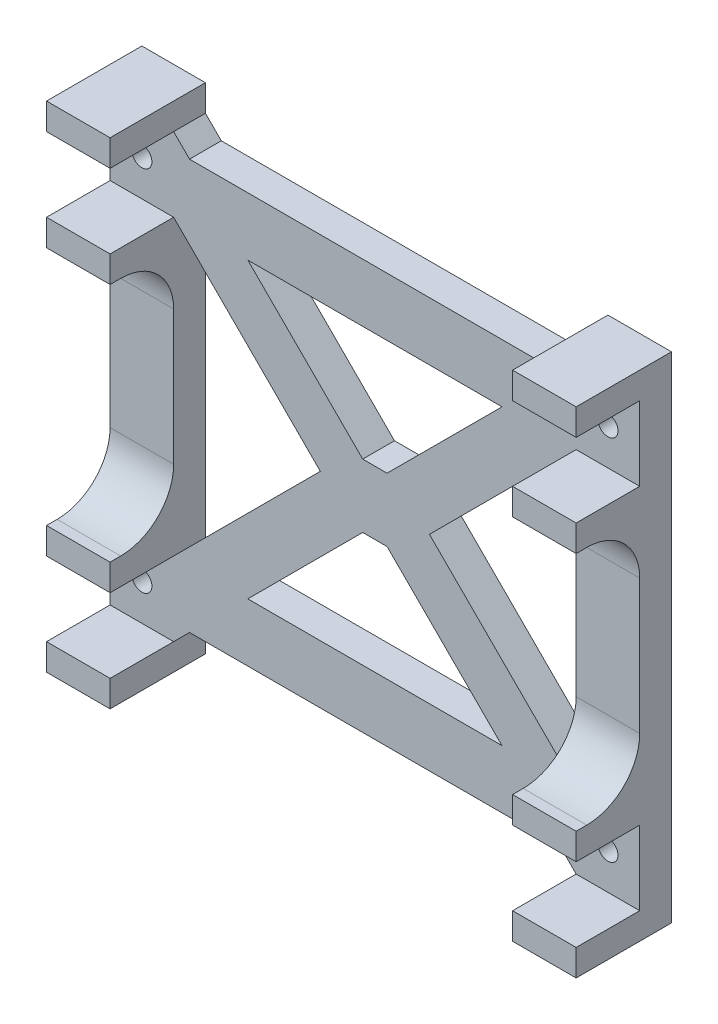
from build123d import *

# Parameters (mm, degrees)
ESQUISSE1_W                    = 6
ESQUISSE1_H                    = 42.7
ESQUISSE1_R                    = 0.95
BOSS_EXTRU_1_DEPTH             = 3
ESQUISSE2_W                    = 6
ESQUISSE2_H                    = 2.5
BOSS_EXTRU_2_DEPTH             = 6
BOSS_EXTRU_2_DIRECTION_2_REACH = 40.932
ESQUISSE3_W                    = 3
ESQUISSE3_H                    = 46.7
BOSS_EXTRU_4_DEPTH             = 44
ESQUISSE4_W                    = 9
ESQUISSE4_H                    = 2.5
BOSS_EXTRU_5_DEPTH             = 6
ENL_V_MAT_EXTRU_1_REACH        = 64.462
ESQUISSE5_R                    = 0.95
ENL_V_MAT_EXTRU_2_REACH        = 64.462
CONG_1_R                       = 5


with BuildPart() as part:
    # Esquisse1 → Boss.-Extru.1 (new body)
    with BuildSketch(Plane.XY):
        with Locations((0, 17.35)):
            Rectangle(ESQUISSE1_W, ESQUISSE1_H)
        Circle(ESQUISSE1_R, mode=Mode.SUBTRACT)
        with Locations((0, 34.7)):
            Circle(ESQUISSE1_R, mode=Mode.SUBTRACT)
    extrude(amount=BOSS_EXTRU_1_DEPTH)

    # Esquisse2 → Boss.-Extru.2 (add)
    with BuildSketch(Plane.XY.offset(3)):
        with Locations((0, 4.75)):
            Rectangle(ESQUISSE2_W, ESQUISSE2_H)
        with Locations((0, 39.45)):
            Rectangle(ESQUISSE2_W, ESQUISSE2_H)
        with Locations((0, 29.95)):
            Rectangle(ESQUISSE2_W, ESQUISSE2_H)
        with Locations((0, -4.75)):
            Rectangle(ESQUISSE2_W, ESQUISSE2_H)
    extrude(amount=BOSS_EXTRU_2_DEPTH)

    # Boss.-Extru.2 direction 2: up to this face of the body (flat: up to its plane)
    boss_extru_2_direction_2_end = Plane(part.part.faces().sort_by_distance((0, 17.35, 0))[0])
    # Esquisse2 → Boss.-Extru.2 direction 2 (add, up to the picked face)
    with BuildSketch(Plane.XY.offset(3), mode=Mode.PRIVATE) as boss_extru_2_direction_2_sk1:
        with Locations((0, 4.75)):
            Rectangle(ESQUISSE2_W, ESQUISSE2_H)
    boss_extru_2_direction_2_tool1 = split(extrude(boss_extru_2_direction_2_sk1.sketch, amount=-BOSS_EXTRU_2_DIRECTION_2_REACH, mode=Mode.PRIVATE), bisect_by=boss_extru_2_direction_2_end, keep=Keep.BOTH, mode=Mode.PRIVATE)
    # Esquisse2 → Boss.-Extru.2 direction 2 (add, up to the picked face)
    with BuildSketch(Plane.XY.offset(3), mode=Mode.PRIVATE) as boss_extru_2_direction_2_sk2:
        with Locations((0, 39.45)):
            Rectangle(ESQUISSE2_W, ESQUISSE2_H)
    boss_extru_2_direction_2_tool2 = split(extrude(boss_extru_2_direction_2_sk2.sketch, amount=-BOSS_EXTRU_2_DIRECTION_2_REACH, mode=Mode.PRIVATE), bisect_by=boss_extru_2_direction_2_end, keep=Keep.BOTH, mode=Mode.PRIVATE)
    # Esquisse2 → Boss.-Extru.2 direction 2 (add, up to the picked face)
    with BuildSketch(Plane.XY.offset(3), mode=Mode.PRIVATE) as boss_extru_2_direction_2_sk3:
        with Locations((0, 29.95)):
            Rectangle(ESQUISSE2_W, ESQUISSE2_H)
    boss_extru_2_direction_2_tool3 = split(extrude(boss_extru_2_direction_2_sk3.sketch, amount=-BOSS_EXTRU_2_DIRECTION_2_REACH, mode=Mode.PRIVATE), bisect_by=boss_extru_2_direction_2_end, keep=Keep.BOTH, mode=Mode.PRIVATE)
    # Esquisse2 → Boss.-Extru.2 direction 2 (add, up to the picked face)
    with BuildSketch(Plane.XY.offset(3), mode=Mode.PRIVATE) as boss_extru_2_direction_2_sk4:
        with Locations((0, -4.75)):
            Rectangle(ESQUISSE2_W, ESQUISSE2_H)
    boss_extru_2_direction_2_tool4 = split(extrude(boss_extru_2_direction_2_sk4.sketch, amount=-BOSS_EXTRU_2_DIRECTION_2_REACH, mode=Mode.PRIVATE), bisect_by=boss_extru_2_direction_2_end, keep=Keep.BOTH, mode=Mode.PRIVATE)
    add(boss_extru_2_direction_2_tool1.solids().sort_by(Axis((0, 4.75, 3), (0, 0, -1)))[0])
    add(boss_extru_2_direction_2_tool2.solids().sort_by(Axis((0, 39.45, 3), (0, 0, -1)))[0])
    add(boss_extru_2_direction_2_tool3.solids().sort_by(Axis((0, 29.95, 3), (0, 0, -1)))[0])
    add(boss_extru_2_direction_2_tool4.solids().sort_by(Axis((0, -4.75, 3), (0, 0, -1)))[0])

    # Esquisse3 → Boss.-Extru.4 (add)
    with BuildSketch(Plane.ZY.offset(3)):
        with Locations((1.5, 17.35)):
            Rectangle(ESQUISSE3_W, ESQUISSE3_H)
    extrude(amount=BOSS_EXTRU_4_DEPTH)

    # Esquisse4 → Boss.-Extru.5 (add)
    with BuildSketch(Plane.ZY.offset(47)):
        with Locations((4.5, 39.45)):
            Rectangle(ESQUISSE4_W, ESQUISSE4_H)
        with Locations((4.5, 29.95)):
            Rectangle(ESQUISSE4_W, ESQUISSE4_H)
        with Locations((4.5, 4.75)):
            Rectangle(ESQUISSE4_W, ESQUISSE4_H)
        with Locations((4.5, -4.75)):
            Rectangle(ESQUISSE4_W, ESQUISSE4_H)
    extrude(amount=-BOSS_EXTRU_5_DEPTH)

    # Esquisse5 → Enlèv. mat.-Extru.1 (cut, up to next)
    with BuildSketch(Plane.XY.offset(3), mode=Mode.PRIVATE) as enl_v_mat_extru_1_sk1:
        with Locations((-44, 34.7)):
            Circle(ESQUISSE5_R)
    enl_v_mat_extru_1_tool1 = extrude(enl_v_mat_extru_1_sk1.sketch, amount=-ENL_V_MAT_EXTRU_1_REACH, mode=Mode.PRIVATE) & part.part
    # Esquisse5 → Enlèv. mat.-Extru.1 (cut, up to next)
    with BuildSketch(Plane.XY.offset(3), mode=Mode.PRIVATE) as enl_v_mat_extru_1_sk2:
        with Locations((-44, 0)):
            Circle(ESQUISSE5_R)
    enl_v_mat_extru_1_tool2 = extrude(enl_v_mat_extru_1_sk2.sketch, amount=-ENL_V_MAT_EXTRU_1_REACH, mode=Mode.PRIVATE) & part.part
    add(enl_v_mat_extru_1_tool1.solids().sort_by_distance((-44, 34.7, 3))[0], mode=Mode.SUBTRACT)
    add(enl_v_mat_extru_1_tool2.solids().sort_by_distance((-44, 0, 3))[0], mode=Mode.SUBTRACT)

    # Esquisse6 → Enlèv. mat.-Extru.2 (cut, up to next)
    with BuildSketch(Plane.XY.offset(3), mode=Mode.PRIVATE) as enl_v_mat_extru_2_sk1:
        Polygon((-20.85, 20.35), (-23.15, 20.35), (-34, 31.2), (-10, 31.2), align=None)
    enl_v_mat_extru_2_tool1 = extrude(enl_v_mat_extru_2_sk1.sketch, amount=-ENL_V_MAT_EXTRU_2_REACH, mode=Mode.PRIVATE) & part.part
    # Esquisse6 → Enlèv. mat.-Extru.2 (cut, up to next)
    with BuildSketch(Plane.XY.offset(3), mode=Mode.PRIVATE) as enl_v_mat_extru_2_sk2:
        Polygon((-41, 28.7), (-41, 6), (-41, 3.5), (-27.15, 17.35), (-41, 31.2), align=None)
    enl_v_mat_extru_2_tool2 = extrude(enl_v_mat_extru_2_sk2.sketch, amount=-ENL_V_MAT_EXTRU_2_REACH, mode=Mode.PRIVATE) & part.part
    # Esquisse6 → Enlèv. mat.-Extru.2 (cut, up to next)
    with BuildSketch(Plane.XY.offset(3), mode=Mode.PRIVATE) as enl_v_mat_extru_2_sk3:
        Polygon((-3, 28.7), (-3, 6), (-3, 3.5), (-16.85, 17.35), (-3, 31.2), align=None)
    enl_v_mat_extru_2_tool3 = extrude(enl_v_mat_extru_2_sk3.sketch, amount=-ENL_V_MAT_EXTRU_2_REACH, mode=Mode.PRIVATE) & part.part
    # Esquisse6 → Enlèv. mat.-Extru.2 (cut, up to next)
    with BuildSketch(Plane.XY.offset(3), mode=Mode.PRIVATE) as enl_v_mat_extru_2_sk4:
        Polygon((-34, 3.5), (-23.15, 14.35), (-20.85, 14.35), (-10, 3.5), align=None)
    enl_v_mat_extru_2_tool4 = extrude(enl_v_mat_extru_2_sk4.sketch, amount=-ENL_V_MAT_EXTRU_2_REACH, mode=Mode.PRIVATE) & part.part
    # Esquisse6 → Enlèv. mat.-Extru.2 (cut, up to next)
    with BuildSketch(Plane.XY.offset(3), mode=Mode.PRIVATE) as enl_v_mat_extru_2_sk5:
        Polygon((-39.5, -2), (-41, -3.5), (-41, -6), (-3, -6), (-3, -3.5), (-4.5, -2), align=None)
    enl_v_mat_extru_2_tool5 = extrude(enl_v_mat_extru_2_sk5.sketch, amount=-ENL_V_MAT_EXTRU_2_REACH, mode=Mode.PRIVATE) & part.part
    # Esquisse6 → Enlèv. mat.-Extru.2 (cut, up to next)
    with BuildSketch(Plane.XY.offset(3), mode=Mode.PRIVATE) as enl_v_mat_extru_2_sk6:
        Polygon((-41, 40.7), (-41, 38.2), (-39.5, 36.7), (-4.5, 36.7), (-3, 38.2), (-3, 40.7), align=None)
    enl_v_mat_extru_2_tool6 = extrude(enl_v_mat_extru_2_sk6.sketch, amount=-ENL_V_MAT_EXTRU_2_REACH, mode=Mode.PRIVATE) & part.part
    add(enl_v_mat_extru_2_tool1.solids().sort_by_distance((-22, 27.267047, 3))[0], mode=Mode.SUBTRACT)
    add(enl_v_mat_extru_2_tool2.solids().sort_by_distance((-36.383333, 17.35, 3))[0], mode=Mode.SUBTRACT)
    add(enl_v_mat_extru_2_tool3.solids().sort_by_distance((-7.616667, 17.35, 3))[0], mode=Mode.SUBTRACT)
    add(enl_v_mat_extru_2_tool4.solids().sort_by_distance((-22, 7.432953, 3))[0], mode=Mode.SUBTRACT)
    add(enl_v_mat_extru_2_tool5.solids().sort_by_distance((-22, -4.022538, 3))[0], mode=Mode.SUBTRACT)
    add(enl_v_mat_extru_2_tool6.solids().sort_by_distance((-22, 38.722538, 3))[0], mode=Mode.SUBTRACT)

    # Congé1
    cong_1_edges = [part.edges().sort_by_distance(p)[0] for p in [
        (-44, 28.7, 3),
        (-44, 6, 3),
        (0, 6, 3),
        (0, 28.7, 3),
    ]]
    fillet(cong_1_edges, radius=CONG_1_R)


solid = part.part
